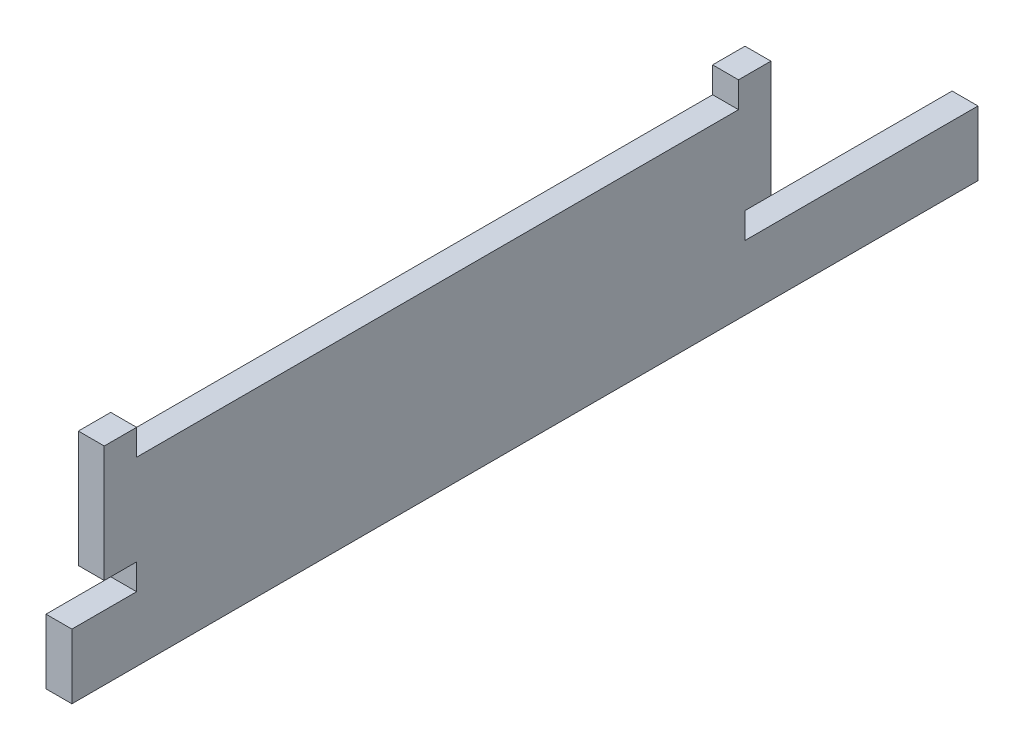
from build123d import *

# Parameters (mm, degrees)
BOSS_EXTRUDE1_DEPTH = 4


with BuildPart() as part:
    # Sketch1 → Boss-Extrude1 (new body)
    with BuildSketch(Plane(origin=(0, 0, 0), x_dir=(0, 0, -1), z_dir=(1, 0, 0))):
        Polygon((-10.235772358, 17.398373984), (-10.235772358, -0.601626016), (-5.235772358, -0.601626016), (-5.235772358, -4.601626016), (-15.235772358, -4.601626016), (-15.235772358, -14.601626016), (124.764227642, -14.601626016), (124.764227642, -4.601626016), (88.764227642, -4.601626016), (88.764227642, -0.601626016), (92.764227642, -0.601626016), (92.764227642, 17.398373984), (87.764227642, 17.398373984), (87.764227642, 13.398373984), (-5.235772358, 13.398373984), (-5.235772358, 17.398373984), align=None)
    extrude(amount=BOSS_EXTRUDE1_DEPTH)


solid = part.part
